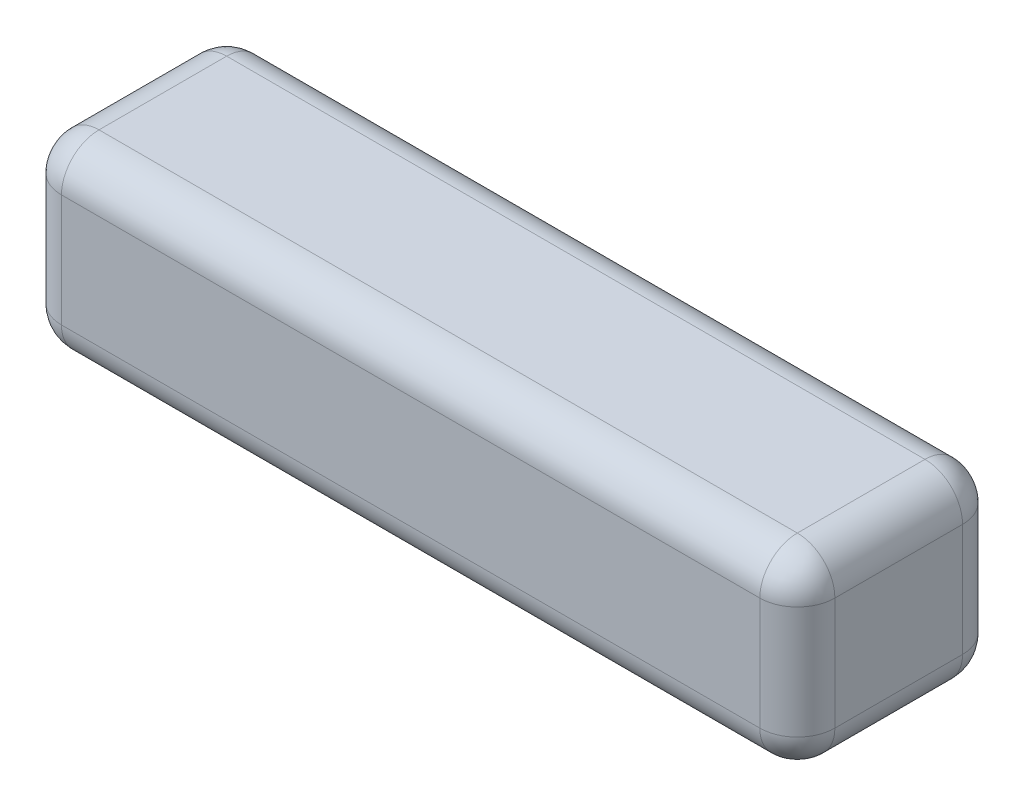
from build123d import *

# Parameters (mm, degrees)
SKETCH1_W           = 103
SKETCH1_H           = 27
BOSS_EXTRUDE1_DEPTH = 25
FILLET1_R           = 5


with BuildPart() as part:
    # Sketch1 → Boss-Extrude1 (new body)
    with BuildSketch(Plane(origin=(0, 0, 0), x_dir=(1, 0, 0), z_dir=(0, 1, 0))):
        Rectangle(SKETCH1_W, SKETCH1_H)
    extrude(amount=BOSS_EXTRUDE1_DEPTH)

    # Fillet1
    fillet1_edges = [part.edges().sort_by_distance(p)[0] for p in [
        (-51.5, 25, 0),
        (0, 25, 13.5),
        (51.5, 25, 0),
        (0, 0, 13.5),
        (-51.5, 0, 0),
        (0, 0, -13.5),
        (51.5, 0, 0),
        (51.5, 12.5, 13.5),
        (-51.5, 12.5, 13.5),
        (-51.5, 12.5, -13.5),
        (51.5, 12.5, -13.5),
        (0, 25, -13.5),
    ]]
    fillet(fillet1_edges, radius=FILLET1_R)


solid = part.part
